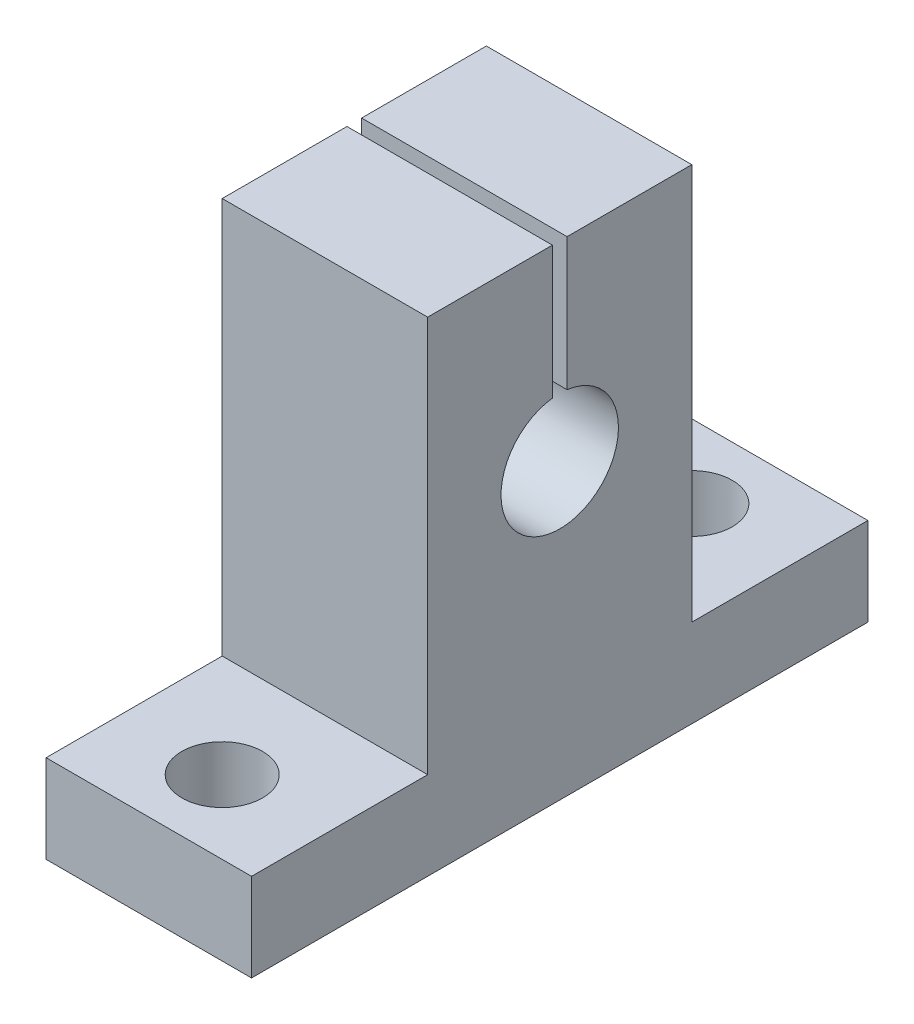
from build123d import *

# Parameters (mm, degrees)
BOSS_EXTRUDE1_DEPTH     = 14
CUT_EXTRUDE1_DEPTH      = 37.959437225
CUT_EXTRUDE1_DEPTH_BACK = 37.959437225
SKETCH2_R               = 2.75


with BuildPart() as part:
    # Sketch1 → Boss-Extrude1 (new body)
    with BuildSketch(Plane(origin=(0, 0, 0), x_dir=(0, 0, -1), z_dir=(1, 0, 0))):
        with BuildLine():
            Line((21, -20), (-21, -20))
            Line((-21, -20), (-21, -14))
            Line((-21, -14), (-9, -14))
            Line((-9, -14), (-9, 13))
            Line((-9, 13), (-0.5, 13))
            Line((-0.5, 13), (-0.5, 3.968626967))
            ThreePointArc((-0.5, 3.968626967), (0, -4), (0.5, 3.968626967))
            Line((0.5, 3.968626967), (0.5, 13))
            Line((0.5, 13), (9, 13))
            Line((9, 13), (9, -14))
            Line((9, -14), (21, -14))
            Line((21, -14), (21, -20))
        make_face()
    extrude(amount=BOSS_EXTRUDE1_DEPTH)

    # Sketch2 → Cut-Extrude1 (cut, two sides: drawn at the far end of the back side and taken through both)
    with BuildSketch(Plane(origin=(0, -14, 0), x_dir=(1, 0, 0), z_dir=(0, 1, 0)).offset(-CUT_EXTRUDE1_DEPTH_BACK)):
        with Locations(Location((7, 16, 0), (0, 0, 270))):
            Circle(SKETCH2_R)
        with Locations(Location((7, -16, 0), (0, 0, 90))):
            Circle(SKETCH2_R)
    extrude(amount=CUT_EXTRUDE1_DEPTH + CUT_EXTRUDE1_DEPTH_BACK, mode=Mode.SUBTRACT)


solid = part.part
